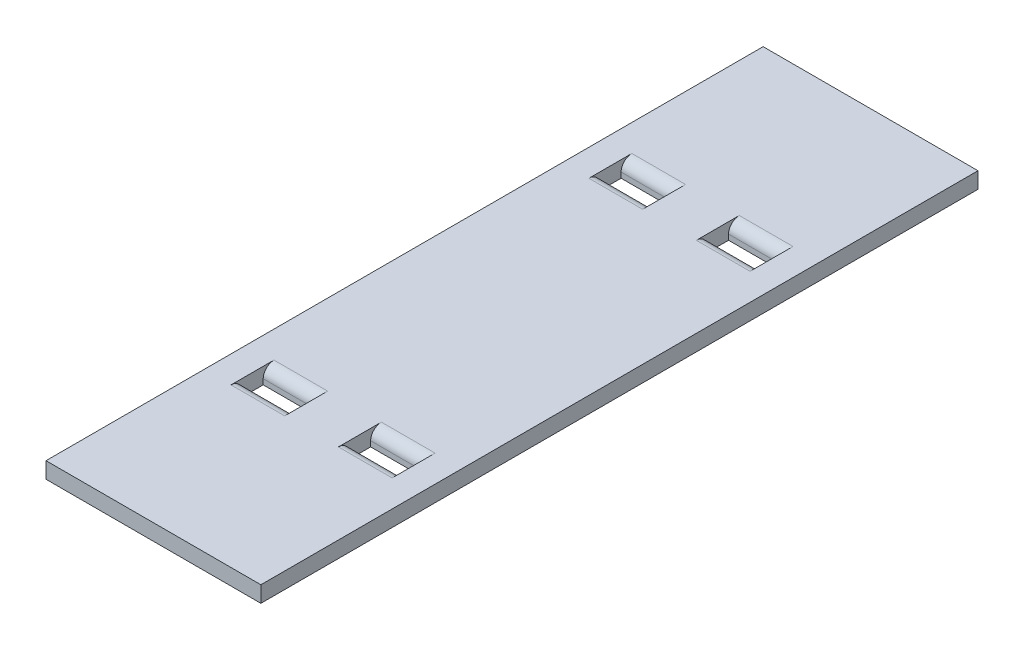
from build123d import *

# Parameters (mm, degrees)
SKETCH1_W           = 40
SKETCH1_H           = 133.5
BOSS_EXTRUDE1_DEPTH = 3
SKETCH2_R           = 6.11
BOSS_EXTRUDE2_DEPTH = 3
CUT_EXTRUDE1_REACH  = 71.94
SKETCH3_W           = 10
SKETCH3_H           = 4
FILLET3_R           = 1
FILLET4_R           = 2


with BuildPart() as part:
    # Sketch1 → Boss-Extrude1 (new body)
    with BuildSketch(Plane(origin=(0, 0, 0), x_dir=(1, 0, 0), z_dir=(0, 1, 0))):
        Rectangle(SKETCH1_W, SKETCH1_H)
    extrude(amount=BOSS_EXTRUDE1_DEPTH)

    # Sketch2 → Boss-Extrude2 (add)
    with BuildSketch(Plane.XZ):
        with Locations(Location((10, 56.75, 0), (0, 0, 90))):
            Circle(SKETCH2_R)
        with Locations(Location((-10, 56.75, 0), (0, 0, 90))):
            Circle(SKETCH2_R)
        with Locations(Location((-10, -56.75, 0), (0, 0, 90))):
            Circle(SKETCH2_R)
        with Locations(Location((10, -56.75, 0), (0, 0, 90))):
            Circle(SKETCH2_R)
    extrude(amount=BOSS_EXTRUDE2_DEPTH)

    # Sketch3 → Cut-Extrude1 (cut, up to next)
    with BuildSketch(Plane(origin=(0, 3, 0), x_dir=(1, 0, 0), z_dir=(0, 1, 0)), mode=Mode.PRIVATE) as cut_extrude1_sk1:
        with Locations((10, 33.3125)):
            Rectangle(SKETCH3_W, SKETCH3_H)
    cut_extrude1_tool1 = extrude(cut_extrude1_sk1.sketch, amount=-CUT_EXTRUDE1_REACH, mode=Mode.PRIVATE) & part.part
    # Sketch3 → Cut-Extrude1 (cut, up to next)
    with BuildSketch(Plane(origin=(0, 3, 0), x_dir=(1, 0, 0), z_dir=(0, 1, 0)), mode=Mode.PRIVATE) as cut_extrude1_sk2:
        with Locations((-10, 33.3125)):
            Rectangle(SKETCH3_W, SKETCH3_H)
    cut_extrude1_tool2 = extrude(cut_extrude1_sk2.sketch, amount=-CUT_EXTRUDE1_REACH, mode=Mode.PRIVATE) & part.part
    # Sketch3 → Cut-Extrude1 (cut, up to next)
    with BuildSketch(Plane(origin=(0, 3, 0), x_dir=(1, 0, 0), z_dir=(0, 1, 0)), mode=Mode.PRIVATE) as cut_extrude1_sk3:
        with Locations((-10, -33.3125)):
            Rectangle(SKETCH3_W, SKETCH3_H)
    cut_extrude1_tool3 = extrude(cut_extrude1_sk3.sketch, amount=-CUT_EXTRUDE1_REACH, mode=Mode.PRIVATE) & part.part
    # Sketch3 → Cut-Extrude1 (cut, up to next)
    with BuildSketch(Plane(origin=(0, 3, 0), x_dir=(1, 0, 0), z_dir=(0, 1, 0)), mode=Mode.PRIVATE) as cut_extrude1_sk4:
        with Locations((10, -33.3125)):
            Rectangle(SKETCH3_W, SKETCH3_H)
    cut_extrude1_tool4 = extrude(cut_extrude1_sk4.sketch, amount=-CUT_EXTRUDE1_REACH, mode=Mode.PRIVATE) & part.part
    add(cut_extrude1_tool1.solids().sort_by_distance((10, 3, -33.3125))[0], mode=Mode.SUBTRACT)
    add(cut_extrude1_tool2.solids().sort_by_distance((-10, 3, -33.3125))[0], mode=Mode.SUBTRACT)
    add(cut_extrude1_tool3.solids().sort_by_distance((-10, 3, 33.3125))[0], mode=Mode.SUBTRACT)
    add(cut_extrude1_tool4.solids().sort_by_distance((10, 3, 33.3125))[0], mode=Mode.SUBTRACT)

    # Fillet3
    fillet3_edges = [part.edges().sort_by_distance(p)[0] for p in [
        (10, -3, -62.86),
        (-10, -3, -62.86),
        (-10, -3, 50.64),
        (10, -3, 50.64),
    ]]
    fillet(fillet3_edges, radius=FILLET3_R)

    # Fillet4
    fillet4_edges = [part.edges().sort_by_distance(p)[0] for p in [
        (10, 3, 35.3125),
        (10, 3, 31.3125),
        (-10, 3, 35.3125),
        (-10, 3, 31.3125),
        (-10, 3, -35.3125),
        (-10, 3, -31.3125),
        (10, 3, -35.3125),
        (10, 3, -31.3125),
    ]]
    fillet(fillet4_edges, radius=FILLET4_R)


solid = part.part
